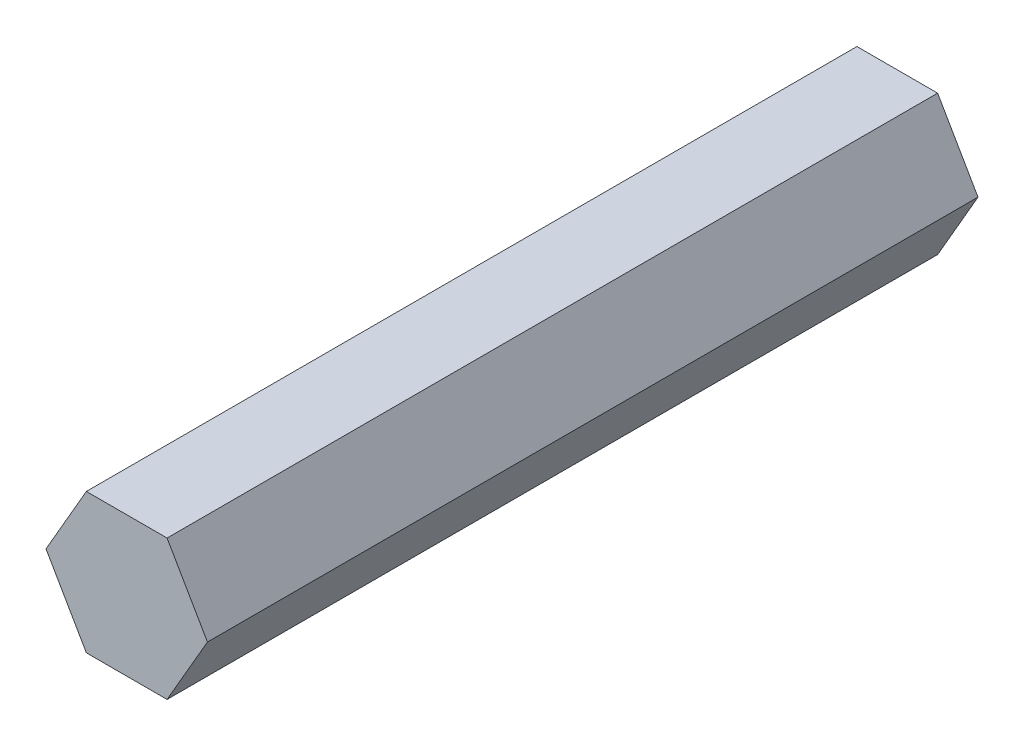
from build123d import *

# Parameters (mm, degrees)
BOSS_EXTRUDE1_DEPTH = 70


with BuildPart() as part:
    # Sketch1 → Boss-Extrude1 (new body)
    with BuildSketch(Plane.XY):
        Polygon((7.332348419, 0), (3.666174209, 6.35), (-3.666174209, 6.35), (-7.332348419, 0), (-3.666174209, -6.35), (3.666174209, -6.35), align=None)
    extrude(amount=BOSS_EXTRUDE1_DEPTH)


solid = part.part
